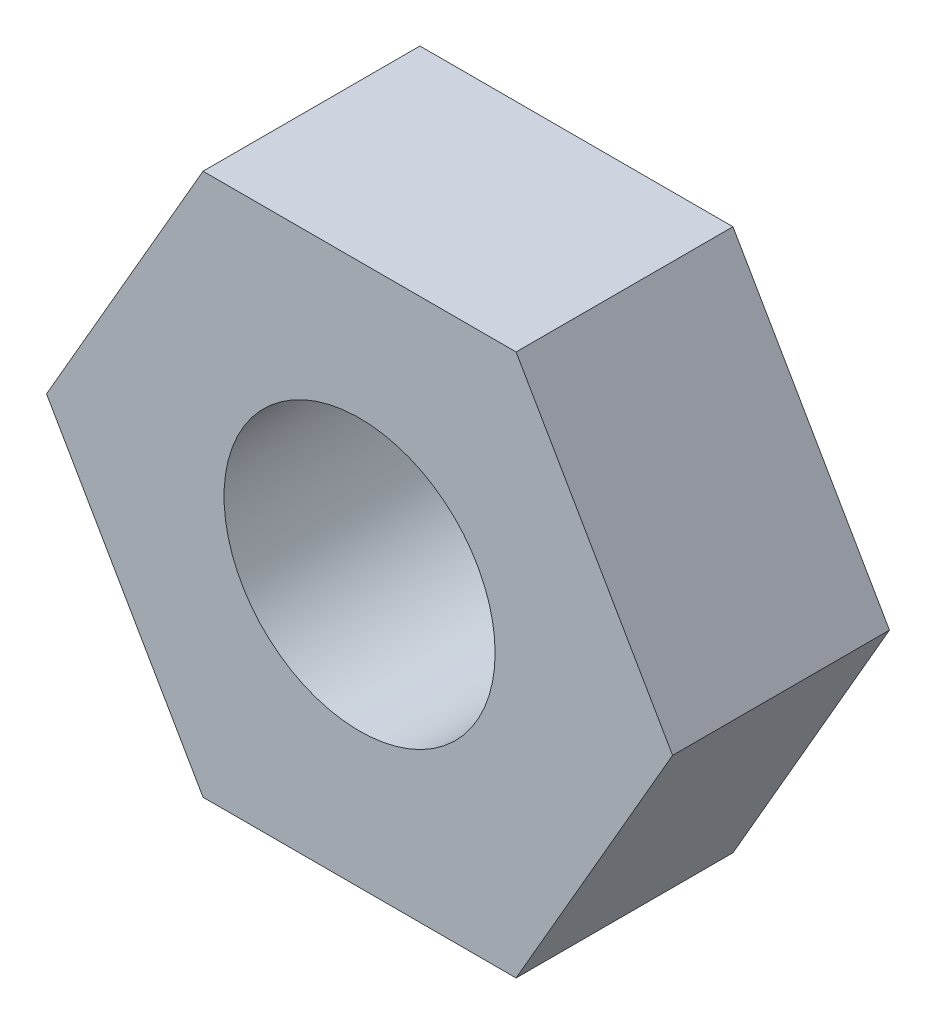
from build123d import *

# Parameters (mm, degrees)
SKETCH1_R          = 1
NUT_ENVELOPE_DEPTH = 1.6


with BuildPart() as part:
    # Sketch1 → Nut_Envelope (new body)
    with BuildSketch(Plane.XY):
        Polygon((2.309401077, 0), (1.154700538, 2), (-1.154700538, 2), (-2.309401077, 0), (-1.154700538, -2), (1.154700538, -2), align=None)
        Circle(SKETCH1_R, mode=Mode.SUBTRACT)
    extrude(amount=NUT_ENVELOPE_DEPTH)


solid = part.part
